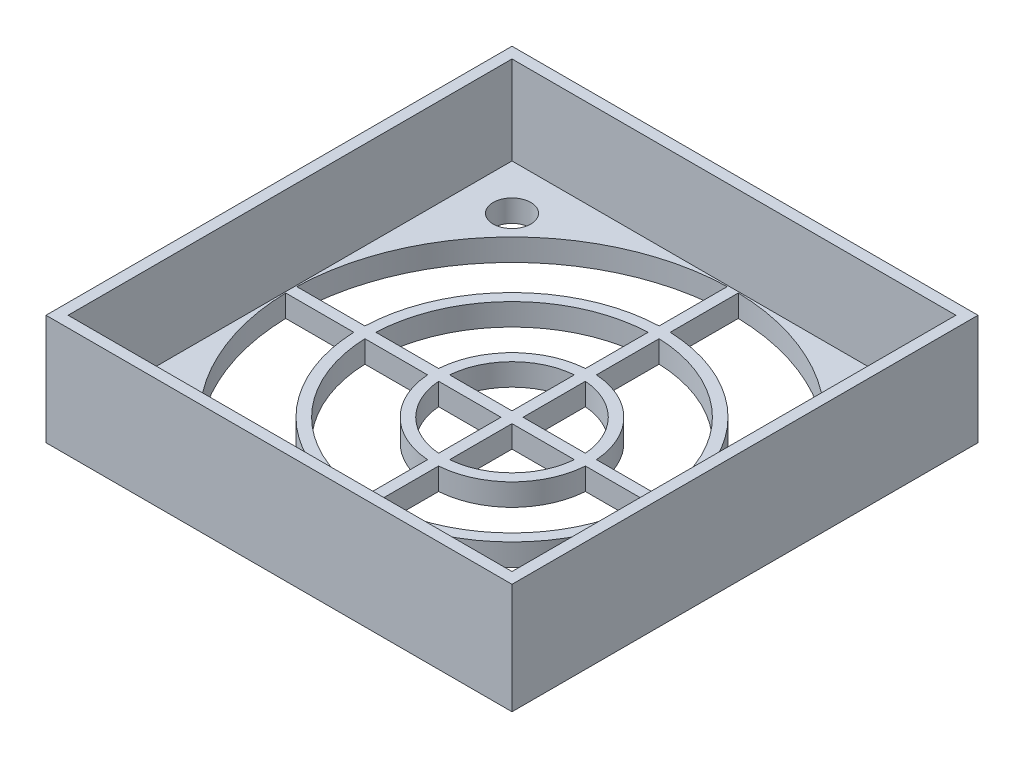
from build123d import *

# Parameters (mm, degrees)
SKETCH1_W           = 42.2
SKETCH1_H           = 42.2
SKETCH1_R           = 1.7
BOSS_EXTRUDE1_DEPTH = 2
SKETCH1_4_W         = 42.2
SKETCH1_4_H         = 42.2
SKETCH1_4_W_2       = 40.2
SKETCH1_4_H_2       = 40.2
BOSS_EXTRUDE2_DEPTH = 10
CUT_EXTRUDE1_DEPTH  = 2
CIRPATTERN1_COUNT   = 4


with BuildPart() as part:
    # Sketch1 → Boss-Extrude1 (new body)
    with BuildSketch(Plane(origin=(0, 0, 0), x_dir=(1, 0, 0), z_dir=(0, 1, 0))):
        Rectangle(SKETCH1_W, SKETCH1_H)
        with Locations(Location((16, 16, 0), (0, 0, 270))):
            Circle(SKETCH1_R, mode=Mode.SUBTRACT)
        with Locations(Location((16, -16, 0), (0, 0, 270))):
            Circle(SKETCH1_R, mode=Mode.SUBTRACT)
        with Locations(Location((-16, -16, 0), (0, 0, 270))):
            Circle(SKETCH1_R, mode=Mode.SUBTRACT)
        with Locations(Location((-16, 16, 0), (0, 0, 270))):
            Circle(SKETCH1_R, mode=Mode.SUBTRACT)
    extrude(amount=BOSS_EXTRUDE1_DEPTH)

    # Sketch1<4> → Boss-Extrude2 (add)
    with BuildSketch(Plane(origin=(0, 0, 0), x_dir=(1, 0, 0), z_dir=(0, 1, 0))):
        Rectangle(SKETCH1_4_W, SKETCH1_4_H)
        Rectangle(SKETCH1_4_W_2, SKETCH1_4_H_2, mode=Mode.SUBTRACT)
    extrude(amount=BOSS_EXTRUDE2_DEPTH)

    # Sketch1<5> → Cut-Extrude1 (cut)
    with BuildSketch(Plane(origin=(0, 0, 0), x_dir=(1, 0, 0), z_dir=(0, 1, 0))):
        with BuildLine():
            ThreePointArc((12.823589374, 0.5), (9.074537025, 9.074537025), (0.5, 12.823589374))
            Line((0.5, 12.823589374), (0.5, 7.14920353))
            ThreePointArc((0.5, 7.14920353), (5.067598599, 5.067598599), (7.14920353, 0.5))
            Line((7.14920353, 0.5), (12.823589374, 0.5))
        make_face()
        with BuildLine():
            ThreePointArc((6.146362972, 0.5), (4.360491817, 4.360491817), (0.5, 6.146362972))
            Line((0.5, 6.146362972), (0.5, 0.5))
            Line((0.5, 0.5), (6.146362972, 0.5))
        make_face()
        with BuildLine():
            Line((0.5, 19.993749023), (0.5, 13.824294236))
            ThreePointArc((0.5, 13.824294236), (9.781643806, 9.781643806), (13.824294236, 0.5))
            Line((13.824294236, 0.5), (19.993749023, 0.5))
            ThreePointArc((19.993749023, 0.5), (14.142135624, 14.142135624), (0.5, 19.993749023))
        make_face()
    cut_extrude1 = extrude(amount=CUT_EXTRUDE1_DEPTH, mode=Mode.SUBTRACT)

    # CirPattern1: Cut-Extrude1 ×4 about axis
    cirpattern1_axis = Axis((0, 0, 0), (0, 1, 0))
    for i in range(1, CIRPATTERN1_COUNT):
        add(cut_extrude1.rotate(cirpattern1_axis, i * 360 / CIRPATTERN1_COUNT), mode=Mode.SUBTRACT)


solid = part.part
